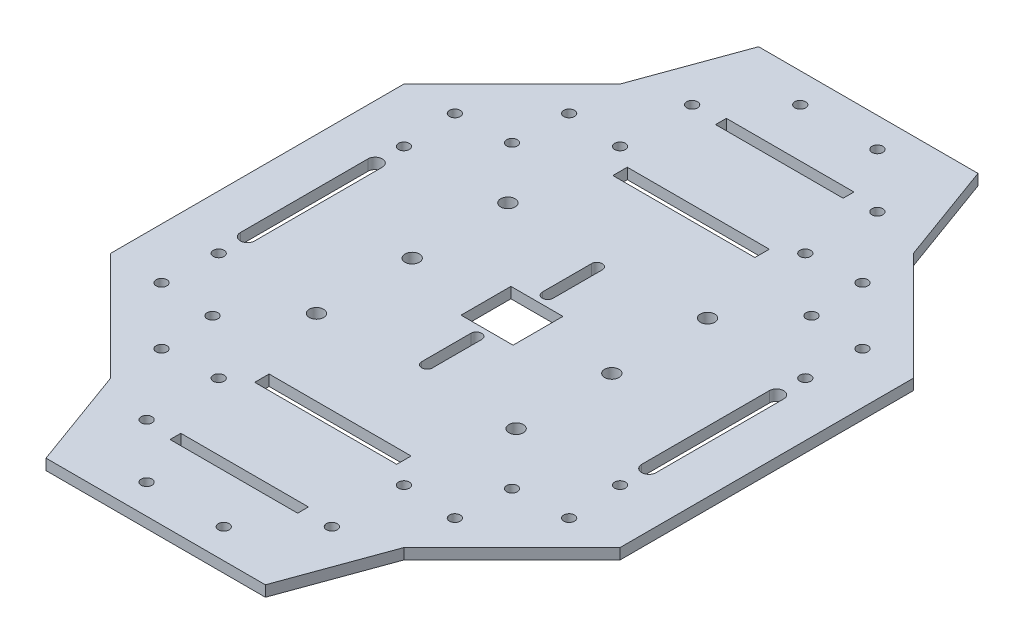
from build123d import *

# Parameters (mm, degrees)
SKETCH_1_W                                 = 141.421356238
SKETCH_1_H                                 = 141.421356238
EXTRUDE_1_DEPTH                            = 3
CUT_EXTRUDE_1_DEPTH                        = 3
MIRROR_1_AT_THE_SECOND_PLANE_COPY_1_DEPTH  = 3
SKETCH_3_R                                 = 1.5
CUT_EXTRUDE_2_DEPTH                        = 3
MIRROR_2_AT_THE_SECOND_PLANE_COPY_1_SKET_R = 1.5
MIRROR_2_AT_THE_SECOND_PLANE_COPY_1_DEPTH  = 3
SKETCH_4_R                                 = 2
CUT_EXTRUDE_3_DEPTH                        = 3
SKETCH_5_R                                 = 1.5
CUT_EXTRUDE_4_DEPTH                        = 3
MIRROR_4_AT_THE_SECOND_PLANE_COPY_1_SKET_R = 1.5
MIRROR_4_AT_THE_SECOND_PLANE_COPY_1_DEPTH  = 3
SKETCH_6_R                                 = 1.5
CUT_EXTRUDE_5_DEPTH                        = 3
MIRROR_5_AT_THE_SECOND_PLANE_COPY_1_SKET_R = 1.5
MIRROR_5_AT_THE_SECOND_PLANE_COPY_1_DEPTH  = 3
CUT_EXTRUDE_6_DEPTH                        = 3
SKETCH_8_W                                 = 14.436516826
SKETCH_8_H                                 = 13.841494932
CUT_EXTRUDE_7_DEPTH                        = 3
CUT_EXTRUDE_8_DEPTH                        = 3
CUT_EXTRUDE_10_DEPTH                       = 3
EXTRUDE_2_DEPTH                            = 3
MIRROR_9_AT_THE_SECOND_PLANE_COPY_1_DEPTH  = 3
SKETCH_13_R                                = 1.5
CUT_EXTRUDE_11_DEPTH                       = 3
MIRROR_11_COPY_1_SKETCH_R                  = 1.5
MIRROR_11_COPY_1_DEPTH                     = 3


with BuildPart() as part:
    # 草图1 → 凸台-拉伸1 (new body)
    with BuildSketch(Plane(origin=(0, 0, 0), x_dir=(1, 0, 0), z_dir=(0, 1, 0))):
        Rectangle(SKETCH_1_W, SKETCH_1_H)
    extrude(amount=EXTRUDE_1_DEPTH)

    # 草图2 → 切除-拉伸1 (cut)
    with BuildSketch(Plane(origin=(0, 0, 0), x_dir=(1, 0, 0), z_dir=(0, 1, 0))):
        Polygon((-70.710678119, 70.710678119), (-40.710678119, 70.710678119), (-70.710678119, 40.710678119), align=None)
    cut_extrude_1 = extrude(amount=CUT_EXTRUDE_1_DEPTH, mode=Mode.SUBTRACT)

    # 镜向1: 切除-拉伸1 across plane
    add(cut_extrude_1.mirror(Plane(origin=(0, 0, 0), x_dir=(0, 0, 1), z_dir=(1, 0, 0))), mode=Mode.SUBTRACT)

    # 镜向1 at the second plane: 切除-拉伸1 across plane
    add(cut_extrude_1.mirror(Plane.XY), mode=Mode.SUBTRACT)

    # 镜向1 at the second plane copy 1 sket → 镜向1 at the second plane copy 1 (cut)
    with BuildSketch(Plane(origin=(0, 0, 0), x_dir=(-1, 0, 0), z_dir=(0, 1, 0))):
        Polygon((-70.710678119, 70.710678119), (-40.710678119, 70.710678119), (-70.710678119, 40.710678119), align=None)
    extrude(amount=MIRROR_1_AT_THE_SECOND_PLANE_COPY_1_DEPTH, mode=Mode.SUBTRACT)

    # 草图3 → 切除-拉伸2 (cut)
    with BuildSketch(Plane(origin=(0, 0, 0), x_dir=(1, 0, 0), z_dir=(0, 1, 0))):
        with Locations(Location((-56.568542495, 40.710678119, 0), (0, 0, 270))):
            Circle(SKETCH_3_R)
        with Locations(Location((-40.710678119, 56.568542495, 0), (0, 0, 270))):
            Circle(SKETCH_3_R)
        with Locations(Location((-41.568542495, 41.568542495, 0), (0, 0, 270))):
            Circle(SKETCH_3_R)
    cut_extrude_2 = extrude(amount=CUT_EXTRUDE_2_DEPTH, mode=Mode.SUBTRACT)

    # 镜向2: 切除-拉伸2 across plane
    add(cut_extrude_2.mirror(Plane.XY), mode=Mode.SUBTRACT)

    # 镜向2 at the second plane: 切除-拉伸2 across plane
    add(cut_extrude_2.mirror(Plane(origin=(0, 0, 0), x_dir=(0, 0, 1), z_dir=(1, 0, 0))), mode=Mode.SUBTRACT)

    # 镜向2 at the second plane copy 1 sket → 镜向2 at the second plane copy 1 (cut)
    with BuildSketch(Plane(origin=(0, 0, 0), x_dir=(-1, 0, 0), z_dir=(0, 1, 0))):
        with Locations(Location((-56.568542495, 40.710678119, 0), (0, 0, 270))):
            Circle(MIRROR_2_AT_THE_SECOND_PLANE_COPY_1_SKET_R)
        with Locations(Location((-40.710678119, 56.568542495, 0), (0, 0, 270))):
            Circle(MIRROR_2_AT_THE_SECOND_PLANE_COPY_1_SKET_R)
        with Locations(Location((-41.568542495, 41.568542495, 0), (0, 0, 270))):
            Circle(MIRROR_2_AT_THE_SECOND_PLANE_COPY_1_SKET_R)
    extrude(amount=MIRROR_2_AT_THE_SECOND_PLANE_COPY_1_DEPTH, mode=Mode.SUBTRACT)

    # 草图4 → 切除-拉伸3 (cut)
    with BuildSketch(Plane(origin=(0, 0, 0), x_dir=(1, 0, 0), z_dir=(0, 1, 0))):
        with Locations(Location((-27.710678119, 26.568542495, 0), (0, 0, 270))):
            Circle(SKETCH_4_R)
        with Locations(Location((-27.710678119, -26.568542495, 0), (0, 0, 270))):
            Circle(SKETCH_4_R)
        with Locations(Location((-27.710678119, 0, 0), (0, 0, 270))):
            Circle(SKETCH_4_R)
    cut_extrude_3 = extrude(amount=CUT_EXTRUDE_3_DEPTH, mode=Mode.SUBTRACT)

    # 镜向3: 切除-拉伸3 across plane
    add(cut_extrude_3.mirror(Plane(origin=(0, 0, 0), x_dir=(0, 0, 1), z_dir=(1, 0, 0))), mode=Mode.SUBTRACT)

    # 草图5 → 切除-拉伸4 (cut)
    with BuildSketch(Plane(origin=(0, 0, 0), x_dir=(1, 0, 0), z_dir=(0, 1, 0))):
        with Locations(Location((-55.710678119, 25.710678119, 0), (0, 0, 270))):
            Circle(SKETCH_5_R)
    cut_extrude_4 = extrude(amount=CUT_EXTRUDE_4_DEPTH, mode=Mode.SUBTRACT)

    # 镜向4: 切除-拉伸4 across plane
    add(cut_extrude_4.mirror(Plane(origin=(0, 0, 0), x_dir=(0, 0, 1), z_dir=(1, 0, 0))), mode=Mode.SUBTRACT)

    # 镜向4 at the second plane: 切除-拉伸4 across plane
    add(cut_extrude_4.mirror(Plane.XY), mode=Mode.SUBTRACT)

    # 镜向4 at the second plane copy 1 sket → 镜向4 at the second plane copy 1 (cut)
    with BuildSketch(Plane(origin=(0, 0, 0), x_dir=(-1, 0, 0), z_dir=(0, 1, 0))):
        with Locations(Location((-55.710678119, 25.710678119, 0), (0, 0, 270))):
            Circle(MIRROR_4_AT_THE_SECOND_PLANE_COPY_1_SKET_R)
    extrude(amount=MIRROR_4_AT_THE_SECOND_PLANE_COPY_1_DEPTH, mode=Mode.SUBTRACT)

    # 草图6 → 切除-拉伸5 (cut)
    with BuildSketch(Plane(origin=(0, 0, 0), x_dir=(1, 0, 0), z_dir=(0, 1, 0))):
        with Locations(Location((-25.710678119, 55.710678119, 0), (0, 0, 270))):
            Circle(SKETCH_6_R)
    cut_extrude_5 = extrude(amount=CUT_EXTRUDE_5_DEPTH, mode=Mode.SUBTRACT)

    # 镜向5: 切除-拉伸5 across plane
    add(cut_extrude_5.mirror(Plane.XY), mode=Mode.SUBTRACT)

    # 镜向5 at the second plane: 切除-拉伸5 across plane
    add(cut_extrude_5.mirror(Plane(origin=(0, 0, 0), x_dir=(0, 0, 1), z_dir=(1, 0, 0))), mode=Mode.SUBTRACT)

    # 镜向5 at the second plane copy 1 sket → 镜向5 at the second plane copy 1 (cut)
    with BuildSketch(Plane(origin=(0, 0, 0), x_dir=(-1, 0, 0), z_dir=(0, 1, 0))):
        with Locations(Location((-25.710678119, 55.710678119, 0), (0, 0, 270))):
            Circle(MIRROR_5_AT_THE_SECOND_PLANE_COPY_1_SKET_R)
    extrude(amount=MIRROR_5_AT_THE_SECOND_PLANE_COPY_1_DEPTH, mode=Mode.SUBTRACT)

    # 草图7 → 切除-拉伸6 (cut)
    with BuildSketch(Plane(origin=(0, 0, 0), x_dir=(1, 0, 0), z_dir=(0, 1, 0))):
        with BuildLine():
            Line((-53.710678119, 17.710678119), (-53.710678119, -17.710678119))
            ThreePointArc((-53.710678119, -17.710678119), (-55.710678119, -19.710678119), (-57.710678119, -17.710678119))
            Line((-57.710678119, -17.710678119), (-57.710678119, 17.710678119))
            ThreePointArc((-57.710678119, 17.710678119), (-55.710678119, 19.710678119), (-53.710678119, 17.710678119))
        make_face()
    cut_extrude_6 = extrude(amount=CUT_EXTRUDE_6_DEPTH, mode=Mode.SUBTRACT)

    # 镜向6: 切除-拉伸6 across plane
    add(cut_extrude_6.mirror(Plane(origin=(0, 0, 0), x_dir=(0, 0, 1), z_dir=(1, 0, 0))), mode=Mode.SUBTRACT)

    # 草图8 → 切除-拉伸7 (cut)
    with BuildSketch(Plane(origin=(0, 0, 0), x_dir=(1, 0, 0), z_dir=(0, 1, 0))):
        Rectangle(SKETCH_8_W, SKETCH_8_H)
    extrude(amount=CUT_EXTRUDE_7_DEPTH, mode=Mode.SUBTRACT)

    # 草图9 → 切除-拉伸8 (cut)
    with BuildSketch(Plane(origin=(0, 0, 0), x_dir=(1, 0, 0), z_dir=(0, 1, 0))):
        with BuildLine():
            Line((1.5, -9.920747466), (1.5, -23.568542495))
            ThreePointArc((1.5, -23.568542495), (0, -25.068542495), (-1.5, -23.568542495))
            Line((-1.5, -23.568542495), (-1.5, -9.920747466))
            ThreePointArc((-1.5, -9.920747466), (0, -8.420747466), (1.5, -9.920747466))
        make_face()
    cut_extrude_8 = extrude(amount=CUT_EXTRUDE_8_DEPTH, mode=Mode.SUBTRACT)

    # 镜向7: 切除-拉伸8 across plane
    add(cut_extrude_8.mirror(Plane.XY), mode=Mode.SUBTRACT)

    # 草图10 → 切除-拉伸10 (cut)
    with BuildSketch(Plane(origin=(0, 0, 0), x_dir=(1, 0, 0), z_dir=(0, 1, 0))):
        Polygon((-19.710678119, 51.710678119), (-19.710678119, 51.490395466), (-19.710678119, 47.710678119), (19.710678119, 47.710678119), (19.710678119, 51.710678119), align=None)
    cut_extrude_10 = extrude(amount=CUT_EXTRUDE_10_DEPTH, mode=Mode.SUBTRACT)

    # 镜向8: 切除-拉伸10 across plane
    add(cut_extrude_10.mirror(Plane.XY), mode=Mode.SUBTRACT)

    # 草图11 → 凸台-拉伸2 (add)
    with BuildSketch(Plane(origin=(0, 3, 0), x_dir=(1, 0, 0), z_dir=(0, 1, 0))):
        Polygon((-40.710678119, 70.710678119), (-30.450073819, 98.901456742), (30.450073819, 98.901456742), (40.710678119, 70.710678119), align=None)
    extrude_2 = extrude(amount=-EXTRUDE_2_DEPTH)

    # 镜向9: 凸台-拉伸2 across plane
    add(extrude_2.mirror(Plane(origin=(0, 0, 0), x_dir=(0, 0, 1), z_dir=(1, 0, 0))))

    # 镜向9 at the second plane: 凸台-拉伸2 across plane
    add(extrude_2.mirror(Plane.XY))

    # 镜向9 at the second plane copy 1 sket → 镜向9 at the second plane copy 1 (add)
    with BuildSketch(Plane(origin=(0, 3, 0), x_dir=(-1, 0, 0), z_dir=(0, 1, 0))):
        Polygon((-40.710678119, 70.710678119), (-30.450073819, 98.901456742), (30.450073819, 98.901456742), (40.710678119, 70.710678119), align=None)
    extrude(amount=-MIRROR_9_AT_THE_SECOND_PLANE_COPY_1_DEPTH)

    # 草图13 → 切除-拉伸11 (cut)
    with BuildSketch(Plane.XZ):
        with Locations(Location((-25.710678119, 75.710678119, 0), (0, 0, 270))):
            Circle(SKETCH_13_R)
        with Locations(Location((-10.710678119, 90.710678119, 0), (0, 0, 270))):
            Circle(SKETCH_13_R)
        Polygon((-17.710678119, 75.710678119), (-17.710678119, 77.210678119), (0, 77.210678119), (0, 74.210678119), (-17.710678119, 74.210678119), align=None)
    cut_extrude_11 = extrude(amount=-CUT_EXTRUDE_11_DEPTH, mode=Mode.SUBTRACT)

    # 镜向10: 切除-拉伸11 across plane
    add(cut_extrude_11.mirror(Plane(origin=(0, 0, 0), x_dir=(0, 0, 1), z_dir=(1, 0, 0))), mode=Mode.SUBTRACT)

    # 镜向11: 切除-拉伸11 across plane
    add(cut_extrude_11.mirror(Plane.XY), mode=Mode.SUBTRACT)

    # 镜向11 copy 1 sketch → 镜向11 copy 1 (cut)
    with BuildSketch(Plane(origin=(0, 0, 0), x_dir=(-1, 0, 0), z_dir=(0, -1, 0))):
        with Locations(Location((-25.710678119, 75.710678119, 0), (0, 0, 270))):
            Circle(MIRROR_11_COPY_1_SKETCH_R)
        with Locations(Location((-10.710678119, 90.710678119, 0), (0, 0, 270))):
            Circle(MIRROR_11_COPY_1_SKETCH_R)
        Polygon((-17.710678119, 75.710678119), (-17.710678119, 77.210678119), (0, 77.210678119), (0, 74.210678119), (-17.710678119, 74.210678119), align=None)
    extrude(amount=-MIRROR_11_COPY_1_DEPTH, mode=Mode.SUBTRACT)


solid = part.part
